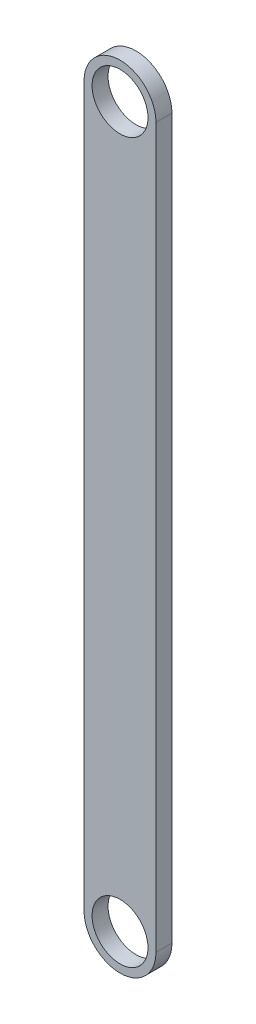
from build123d import *

# Parameters (mm, degrees)
SKETCH1_R           = 88.9
BOSS_EXTRUDE1_DEPTH = 25.4


with BuildPart() as part:
    # Sketch1 → Boss-Extrude1 (new, symmetric)
    with BuildSketch(Plane.XY):
        with BuildLine():
            Line((-114.3, -1143), (-114.3, 1143))
            ThreePointArc((-114.3, 1143), (0, 1257.3), (114.3, 1143))
            Line((114.3, 1143), (114.3, -1143))
            ThreePointArc((114.3, -1143), (0, -1257.3), (-114.3, -1143))
        make_face()
        with Locations((0, 1143)):
            Circle(SKETCH1_R, mode=Mode.SUBTRACT)
        with Locations((0, -1143)):
            Circle(SKETCH1_R, mode=Mode.SUBTRACT)
    extrude(amount=BOSS_EXTRUDE1_DEPTH, both=True)


solid = part.part
